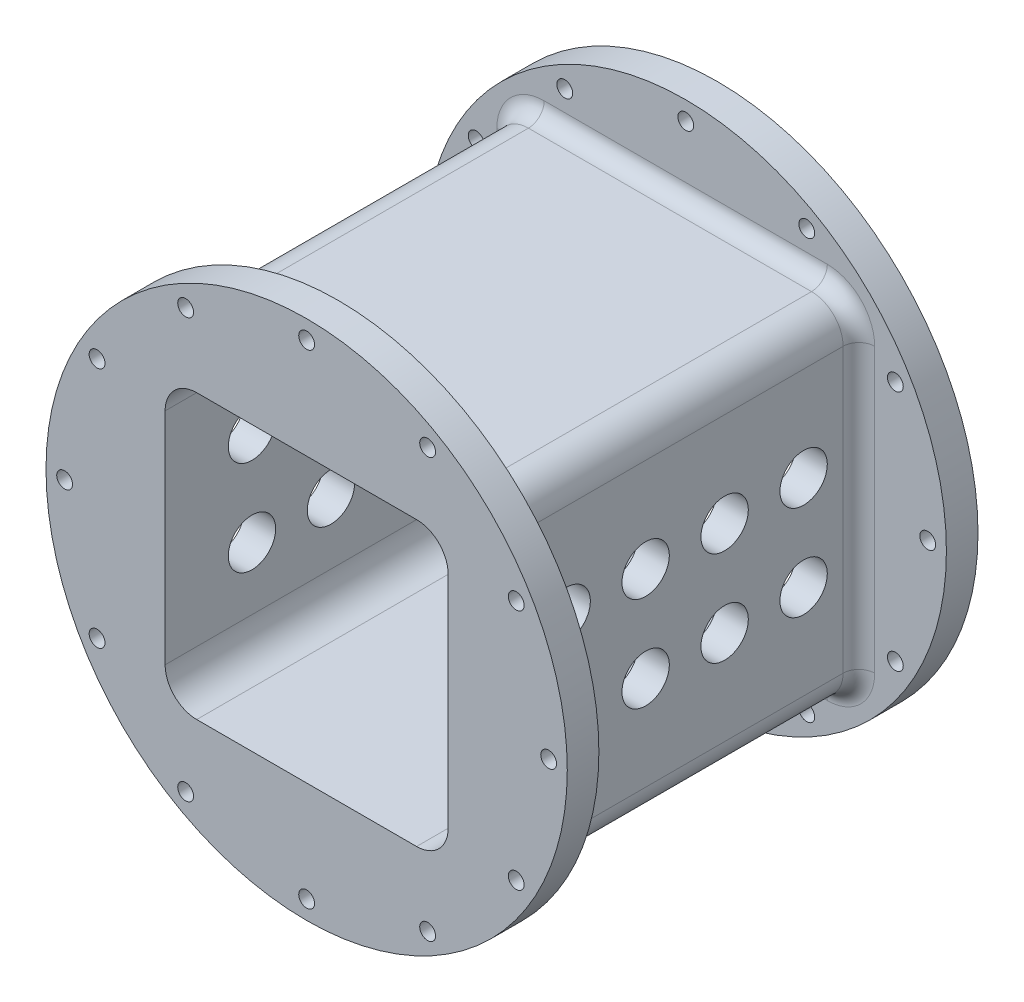
from build123d import *

# Parameters (mm, degrees)
SKETCH2_W               = 139.193969876
SKETCH2_H               = 139.193969876
BOSS_EXTRUDE1_DEPTH     = 76.2
SKETCH3_R               = 104.775
BOSS_EXTRUDE2_DEPTH     = 6.35
SKETCH4_R               = 104.775
BOSS_EXTRUDE3_DEPTH     = 6.35
CUT_EXTRUDE1_DEPTH      = 170.617521943
CUT_EXTRUDE1_DEPTH_BACK = 170.617521943
SKETCH2_3_W             = 113.793969876
SKETCH2_3_H             = 113.793969876
FILLET1_R               = 12.7
SKETCH6_R               = 3.18262
CUT_EXTRUDE2_DEPTH      = 222.841410133
CIRPATTERN1_COUNT       = 12
SKETCH8_R               = 9.525
CUT_EXTRUDE3_DEPTH      = 220.540183694
FILLET2_R               = 6.35


with BuildPart() as part:
    # Sketch2 → Boss-Extrude1 (new, symmetric)
    with BuildSketch(Plane.XY):
        Rectangle(SKETCH2_W, SKETCH2_H)
    extrude(amount=BOSS_EXTRUDE1_DEPTH, both=True)

    # Sketch3 → Boss-Extrude2 (add, symmetric)
    with BuildSketch(Plane.XY.offset(76.2)):
        Circle(SKETCH3_R)
    extrude(amount=BOSS_EXTRUDE2_DEPTH, both=True)

    # Sketch4 → Boss-Extrude3 (add, symmetric)
    with BuildSketch(Plane(origin=(0, 0, -76.2), x_dir=(-1, 0, 0), z_dir=(0, 0, -1))):
        Circle(SKETCH4_R)
    extrude(amount=BOSS_EXTRUDE3_DEPTH, both=True)

    # Sketch2<3> → Cut-Extrude1 (cut, two sides: drawn at the far end of the back side and taken through both)
    with BuildSketch(Plane.XY.offset(-CUT_EXTRUDE1_DEPTH_BACK)):
        Rectangle(SKETCH2_3_W, SKETCH2_3_H)
    extrude(amount=CUT_EXTRUDE1_DEPTH + CUT_EXTRUDE1_DEPTH_BACK, mode=Mode.SUBTRACT)

    # Fillet1
    fillet1_edges = [part.edges().sort_by_distance(p)[0] for p in [
        (69.596984938, -69.596984938, 0),
        (-69.596984938, -69.596984938, 0),
        (-56.896984938, -56.896984938, 0),
        (56.896984938, -56.896984938, 0),
        (56.896984938, 56.896984938, 0),
        (-56.896984938, 56.896984938, 0),
        (69.596984938, 69.596984938, 0),
        (-69.596984938, 69.596984938, 0),
    ]]
    fillet(fillet1_edges, radius=FILLET1_R)

    # Sketch6 → Cut-Extrude2 (cut, symmetric)
    with BuildSketch(Plane.XY.offset(82.55)):
        with Locations((48.641, 84.248683331)):
            Circle(SKETCH6_R)
    cut_extrude2 = extrude(amount=CUT_EXTRUDE2_DEPTH, both=True, mode=Mode.SUBTRACT)

    # CirPattern1: Cut-Extrude2 ×12 about axis
    cirpattern1_axis = Axis((0, 0, 82.55), (0, 0, -1))
    for i in range(1, CIRPATTERN1_COUNT):
        add(cut_extrude2.rotate(cirpattern1_axis, i * 360 / CIRPATTERN1_COUNT), mode=Mode.SUBTRACT)

    # Sketch8 → Cut-Extrude3 (cut, through all)
    with BuildSketch(Plane.ZY.offset(69.596984938)):
        with Locations((-47.625, 19.05)):
            Circle(SKETCH8_R)
        with Locations((47.625, 19.05)):
            Circle(SKETCH8_R)
        with Locations((-15.875, 19.05)):
            Circle(SKETCH8_R)
        with Locations((15.875, 19.05)):
            Circle(SKETCH8_R)
        with Locations((15.875, -19.05)):
            Circle(SKETCH8_R)
        with Locations((-15.875, -19.05)):
            Circle(SKETCH8_R)
        with Locations((47.625, -19.05)):
            Circle(SKETCH8_R)
        with Locations((-47.625, -19.05)):
            Circle(SKETCH8_R)
    extrude(amount=-CUT_EXTRUDE3_DEPTH, mode=Mode.SUBTRACT)

    # Fillet2
    fillet2_edges = [part.edges().sort_by_distance(p)[0] for p in [
        (65.877241059, 65.877241059, -69.85),
        (69.596984938, 0, -69.85),
        (65.877241059, -65.877241059, -69.85),
        (0, -69.596984938, -69.85),
        (-65.877241059, -65.877241059, -69.85),
        (-69.596984938, 0, -69.85),
        (-65.877241059, 65.877241059, -69.85),
        (-65.877241059, 65.877241059, 69.85),
        (-69.596984938, 0, 69.85),
        (-65.877241059, -65.877241059, 69.85),
        (0, -69.596984938, 69.85),
        (65.877241059, -65.877241059, 69.85),
        (69.596984938, 0, 69.85),
        (65.877241059, 65.877241059, 69.85),
        (0, 69.596984938, -69.85),
        (0, 69.596984938, 69.85),
    ]]
    fillet(fillet2_edges, radius=FILLET2_R)


solid = part.part
